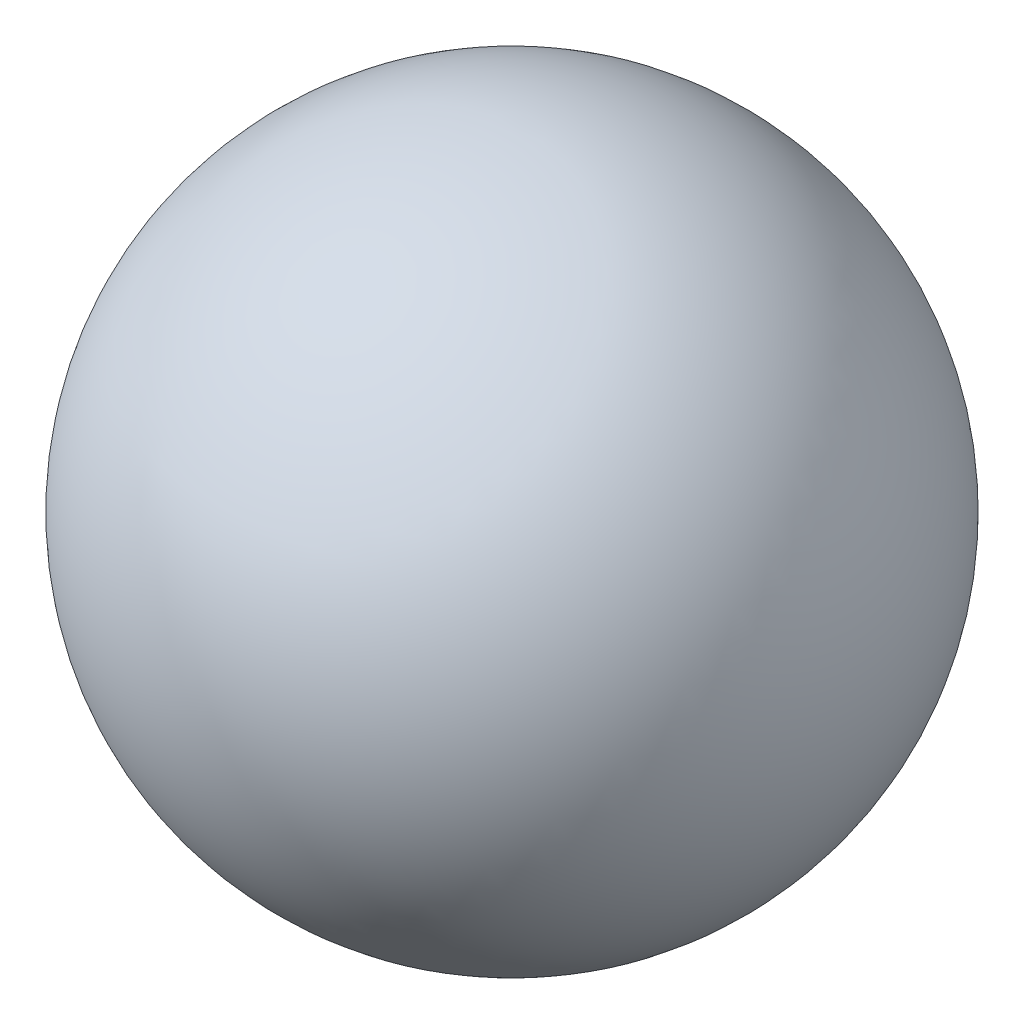
from build123d import *


with BuildPart() as part:
    # Sketch1 → Revolve1 (revolve)
    with BuildSketch(Plane.XY):
        with BuildLine():
            Line((0, -3.209989756), (0, -4.727510244))
            ThreePointArc((0, -4.727510244), (0.758760244, -3.96875), (0, -3.209989756))
        make_face()
    revolve(axis=Axis((0, -3.209989756, 0), (0, -1, 0)))


solid = part.part
